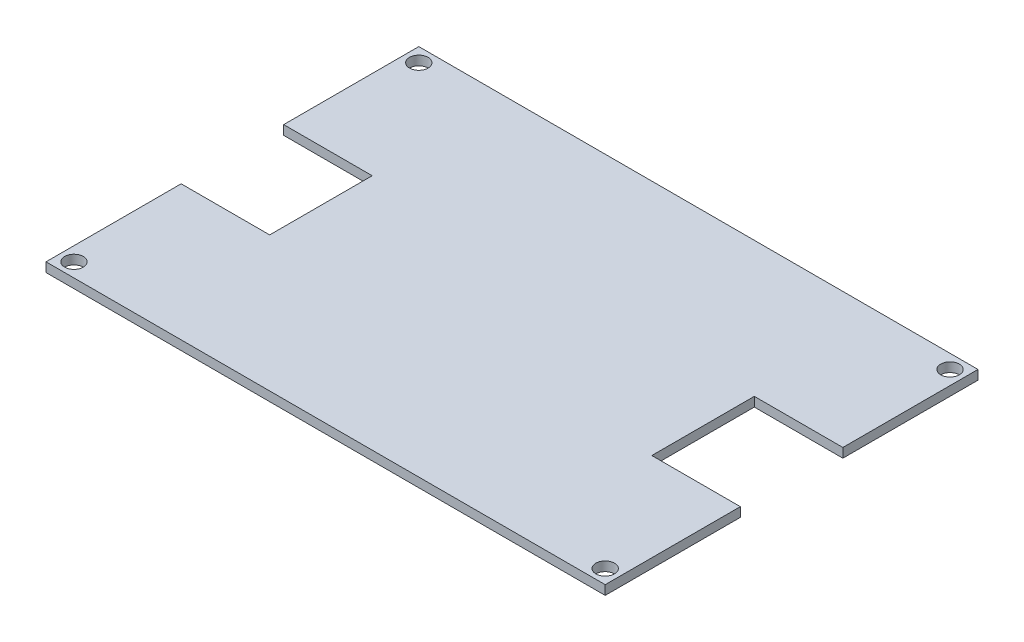
from build123d import *

# Parameters (mm, degrees)
SKETCH1_W               = 120
SKETCH1_H               = 80
BOSS_EXTRUDE1_DEPTH     = 2
CUT_EXTRUDE1_DEPTH      = 20
CUT_EXTRUDE1_DEPTH_BACK = 20
SKETCH2_W               = 19
SKETCH2_H               = 22
CUT_EXTRUDE2_DEPTH      = 20
CUT_EXTRUDE2_DEPTH_BACK = 20
SKETCH3_W               = 19
SKETCH3_H               = 22
CUT_EXTRUDE3_DEPTH      = 20
CUT_EXTRUDE3_DEPTH_BACK = 20
SKETCH4_R               = 2


with BuildPart() as part:
    # Sketch1 → Boss-Extrude1 (new body)
    with BuildSketch(Plane(origin=(0, 0, 0), x_dir=(1, 0, 0), z_dir=(0, 1, 0))):
        Rectangle(SKETCH1_W, SKETCH1_H)
    extrude(amount=BOSS_EXTRUDE1_DEPTH)

    # Sketch2 → Cut-Extrude1 (cut, two sides: drawn at the far end of the back side and taken through both)
    with BuildSketch(Plane(origin=(0, 2, 0), x_dir=(1, 0, 0), z_dir=(0, 1, 0)).offset(-CUT_EXTRUDE1_DEPTH_BACK)):
        with Locations((-50.5, 0)):
            Rectangle(SKETCH2_W, SKETCH2_H)
    extrude(amount=CUT_EXTRUDE1_DEPTH + CUT_EXTRUDE1_DEPTH_BACK, mode=Mode.SUBTRACT)

    # Sketch3 → Cut-Extrude2 (cut, two sides: drawn at the far end of the back side and taken through both)
    with BuildSketch(Plane(origin=(0, 2, 0), x_dir=(1, 0, 0), z_dir=(0, 1, 0)).offset(-CUT_EXTRUDE2_DEPTH_BACK)):
        with Locations((50.5, 0)):
            Rectangle(SKETCH3_W, SKETCH3_H)
    extrude(amount=CUT_EXTRUDE2_DEPTH + CUT_EXTRUDE2_DEPTH_BACK, mode=Mode.SUBTRACT)

    # Sketch4 → Cut-Extrude3 (cut, two sides: drawn at the far end of the back side and taken through both)
    with BuildSketch(Plane(origin=(0, 2, 0), x_dir=(1, 0, 0), z_dir=(0, 1, 0)).offset(-CUT_EXTRUDE3_DEPTH_BACK)):
        with Locations((-57, 37)):
            Circle(SKETCH4_R)
        with Locations((57, 37)):
            Circle(SKETCH4_R)
        with Locations((57, -37)):
            Circle(SKETCH4_R)
        with Locations((-57, -37)):
            Circle(SKETCH4_R)
    extrude(amount=CUT_EXTRUDE3_DEPTH + CUT_EXTRUDE3_DEPTH_BACK, mode=Mode.SUBTRACT)


solid = part.part
